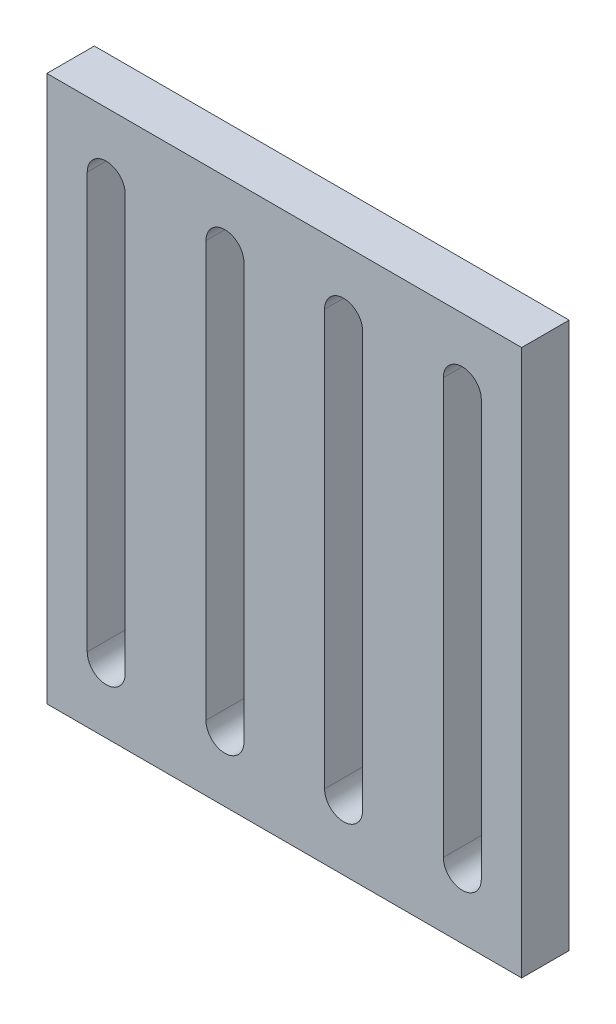
from build123d import *

# Parameters (mm, degrees)
SKETCH1_W           = 10
SKETCH1_H           = 46
BOSS_EXTRUDE1_DEPTH = 4
LPATTERN2_COUNT     = 4
LPATTERN2_PITCH     = 10


with BuildPart() as part:
    # Sketch1 → Boss-Extrude1 (new body)
    with BuildSketch(Plane.XY):
        Rectangle(SKETCH1_W, SKETCH1_H)
        with BuildLine():
            Line((1.6, 17.5), (1.6, -17.5))
            ThreePointArc((1.6, -17.5), (0, -19.1), (-1.6, -17.5))
            Line((-1.6, -17.5), (-1.6, 17.5))
            ThreePointArc((-1.6, 17.5), (0, 19.1), (1.6, 17.5))
        make_face(mode=Mode.SUBTRACT)
    boss_extrude1 = extrude(amount=BOSS_EXTRUDE1_DEPTH)

    # LPattern2: Boss-Extrude1 ×4
    with Locations(*[(-i * LPATTERN2_PITCH, 0, 0) for i in range(1, LPATTERN2_COUNT)]):
        add(boss_extrude1)


solid = part.part
